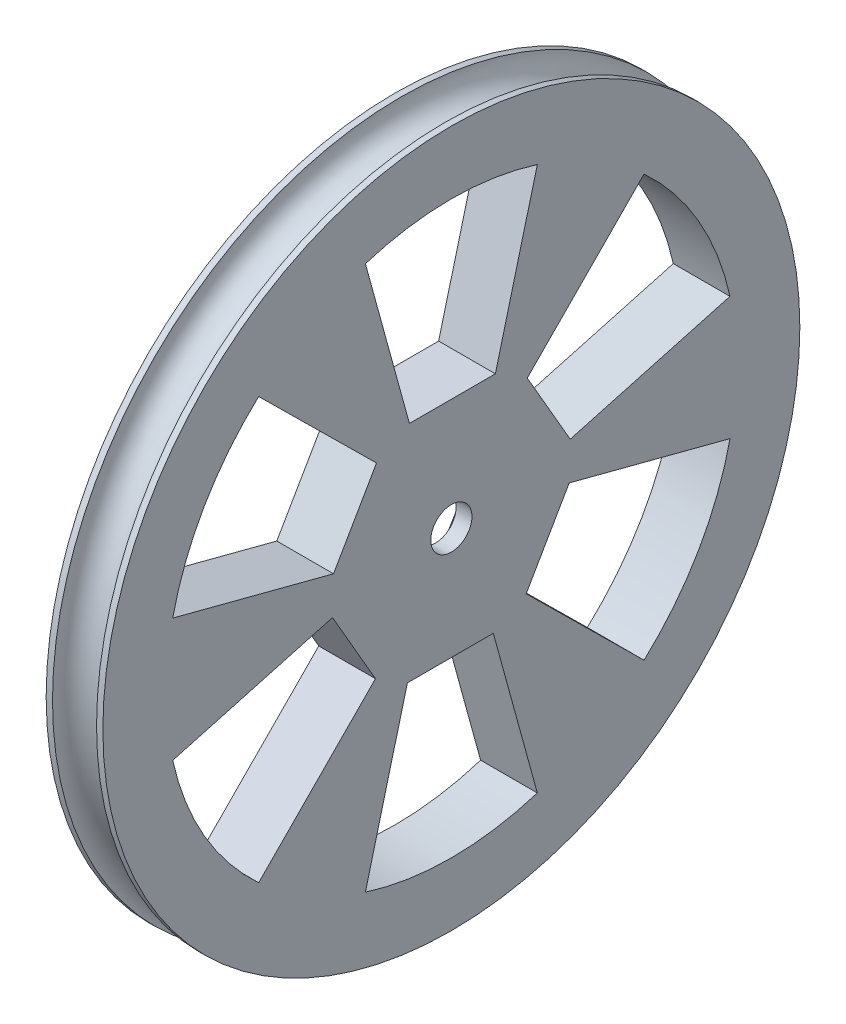
from build123d import *

# Parameters (mm, degrees)
SKETCH2_W          = 0.508
SKETCH2_H          = 27.94
CUT_EXTRUDE1_REACH = 41.774
SKETCH3_R          = 1.651
CIRPATTERN1_COUNT  = 6
SKETCH3_3_R        = 1.651
CUT_EXTRUDE2_DEPTH = 3.2766


with BuildPart() as part:
    # Sketch2 → Revolve1 (revolve)
    with BuildSketch(Plane.XY, mode=Mode.PRIVATE) as revolve1_sk:
        with Locations((-0.254, 13.97)):
            Rectangle(SKETCH2_W, SKETCH2_H)
        with BuildLine():
            ThreePointArc((0, 27.94), (1.7653, 26.1747), (3.5306, 27.94))
            Line((3.5306, 27.94), (3.5306, 0))
            Line((3.5306, 0), (0, 0))
            Line((0, 0), (0, 27.94))
        make_face()
        with Locations((3.7846, 13.97)):
            Rectangle(SKETCH2_W, SKETCH2_H)
    revolve(revolve1_sk.sketch.rotate(Axis((0, 0, 0), (1, 0, 0)), 90), axis=Axis((0, 0, 0), (1, 0, 0)))

    # Sketch3 → Cut-Extrude1 (cut, up to next)
    with BuildSketch(Plane(origin=(-0.508, 0, 0), x_dir=(0, 0, -1), z_dir=(1, 0, 0)), mode=Mode.PRIVATE) as cut_extrude1_sk1:
        with BuildLine():
            ThreePointArc((6.891742224, 21.816499024), (0, 22.879155153), (-6.891742224, 21.816499024))
            Line((-6.891742224, 21.816499024), (-3.362938361, 8.966871047))
            Line((-3.362938361, 8.966871047), (3.528803863, 8.966871047))
            Line((3.528803863, 8.966871047), (6.891742224, 21.816499024))
        make_face()
    cut_extrude1_tool1 = extrude(cut_extrude1_sk1.sketch, amount=CUT_EXTRUDE1_REACH, mode=Mode.PRIVATE) & part.part
    # Sketch3 → Cut-Extrude1 (cut, up to next)
    with BuildSketch(Plane(origin=(-0.508, 0, 0), x_dir=(0, 0, -1), z_dir=(1, 0, 0)), mode=Mode.PRIVATE) as cut_extrude1_sk2:
        with Locations(Location((0, 0, 0), (0, 0, 180))):
            Circle(SKETCH3_R)
    cut_extrude1_tool2 = extrude(cut_extrude1_sk2.sketch, amount=CUT_EXTRUDE1_REACH, mode=Mode.PRIVATE) & part.part
    cut_extrude1_1 = cut_extrude1_tool1.solids().sort_by_distance((-0.508, 16.527641, -0.034324))[0]
    add(cut_extrude1_1, mode=Mode.SUBTRACT)
    cut_extrude1_2 = cut_extrude1_tool2.solids().sort_by_distance((-0.508, 0, 0))[0]
    add(cut_extrude1_2, mode=Mode.SUBTRACT)
    cut_extrude1 = cut_extrude1_1 + cut_extrude1_2  # Cut-Extrude1 as one shape, for the pattern or mirror that repeats it

    # CirPattern1: Cut-Extrude1 ×6 about axis
    cirpattern1_axis = Axis((0, 0, 0), (1, 0, 0))
    for i in range(1, CIRPATTERN1_COUNT):
        add(cut_extrude1.rotate(cirpattern1_axis, i * 360 / CIRPATTERN1_COUNT), mode=Mode.SUBTRACT)

    # Sketch3<3> → Cut-Extrude2 (cut)
    with BuildSketch(Plane(origin=(-0.508, 0, 0), x_dir=(0, 0, -1), z_dir=(1, 0, 0))):
        Polygon((6.984325773, -0.097048964), (3.576209755, 6.000079065), (-3.408116018, 6.09712803), (-6.984325773, 0.097048964), (-3.576209755, -6.000079065), (3.408116018, -6.09712803), align=None)
        Circle(SKETCH3_3_R, mode=Mode.SUBTRACT)
    extrude(amount=CUT_EXTRUDE2_DEPTH, mode=Mode.SUBTRACT)


solid = part.part
